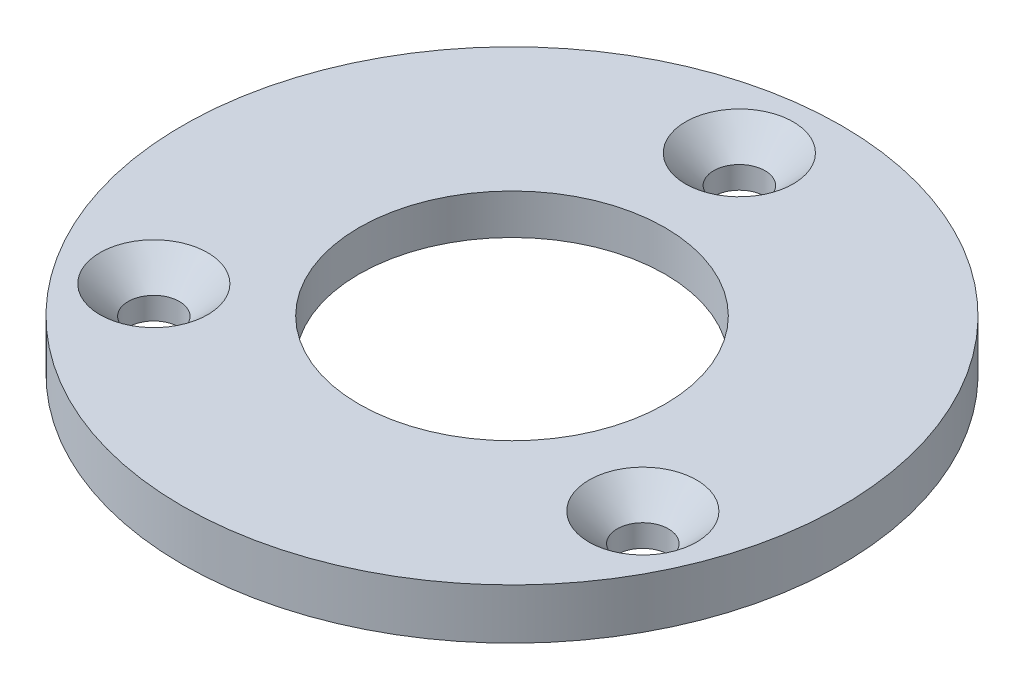
from build123d import *

# Parameters (mm, degrees)
CSK_FOR_M3_SFHCS1_AT_2_COUNT = 2
CSK_FOR_M3_SFHCS1_AT_2_PITCH = 16.002
CSK_FOR_M3_SFHCS1_AT_3_COUNT = 2
CSK_FOR_M3_SFHCS1_AT_3_PITCH = 16.002
CSK_FOR_M3_SFHCS1_AT_4_COUNT = 2
CSK_FOR_M3_SFHCS1_AT_4_PITCH = 16.002


with BuildPart() as part:
    # Sketch1 → Revolve1 (revolve)
    with BuildSketch(Plane.XY, mode=Mode.PRIVATE) as revolve1_sk:
        Polygon((-9.5504, 0), (-20.574, 0), (-20.574, -3.1496), (-13.208, -3.1496), (-13.208, -2.5146), (-9.5504, -2.5146), align=None)
    revolve(revolve1_sk.sketch.rotate(Axis((0, 0, 0), (0, 1, 0)), 270), axis=Axis((0, 0, 0), (0, 1, 0)))

    # Sketch2 → CSK for M3 SFHCS1 (revolve, cut)
    with BuildSketch(Plane(origin=(0, 0, 0), x_dir=(0, 0, 1), z_dir=(1, 0, 0))):
        Polygon((0, 0), (0, 3.1496), (1.6, 3.1496), (1.6, 1.76), (3.36, 0), align=None)
    csk_for_m3_sfhcs1 = revolve(axis=Axis((0, 6.35, 0), (0, -1, 0)), mode=Mode.SUBTRACT)

    # CSK for M3 SFHCS1 at 2: CSK for M3 SFHCS1 ×2
    with Locations(*[Vector(-0.10721238743656843, 0, -0.9942361409545275) * (i * CSK_FOR_M3_SFHCS1_AT_2_PITCH) for i in range(1, CSK_FOR_M3_SFHCS1_AT_2_COUNT)]):
        add(csk_for_m3_sfhcs1, mode=Mode.SUBTRACT)

    # CSK for M3 SFHCS1 at 3: CSK for M3 SFHCS1 ×2
    with Locations(*[Vector(0.9146399491455367, 0, 0.4042694193567579) * (i * CSK_FOR_M3_SFHCS1_AT_3_PITCH) for i in range(1, CSK_FOR_M3_SFHCS1_AT_3_COUNT)]):
        add(csk_for_m3_sfhcs1, mode=Mode.SUBTRACT)

    # CSK for M3 SFHCS1 at 4: CSK for M3 SFHCS1 ×2
    with Locations(*[Vector(-0.8074275617089052, 0, 0.5899667215977628) * (i * CSK_FOR_M3_SFHCS1_AT_4_PITCH) for i in range(1, CSK_FOR_M3_SFHCS1_AT_4_COUNT)]):
        add(csk_for_m3_sfhcs1, mode=Mode.SUBTRACT)


solid = part.part
